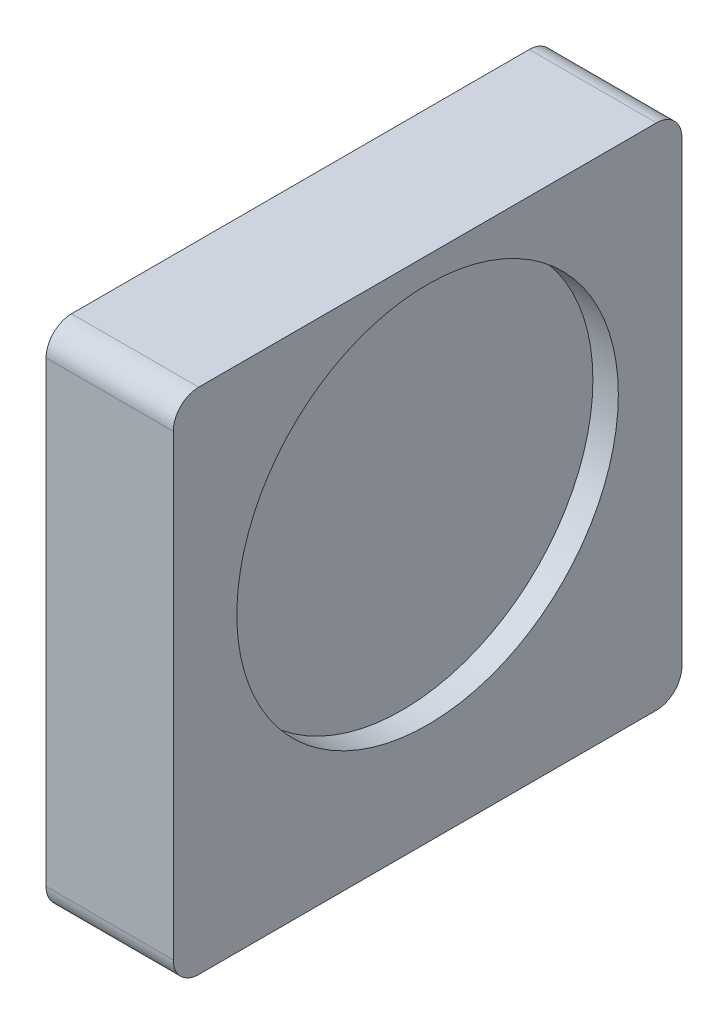
from build123d import *

# Parameters (mm, degrees)
SKETCH1_W           = 40
SKETCH1_H           = 40
BOSS_EXTRUDE1_DEPTH = 10
SKETCH2_R           = 15
CUT_EXTRUDE1_DEPTH  = 2
FILLET1_R           = 2


with BuildPart() as part:
    # Sketch1 → Boss-Extrude1 (new body)
    with BuildSketch(Plane.YZ):
        Rectangle(SKETCH1_W, SKETCH1_H)
    extrude(amount=BOSS_EXTRUDE1_DEPTH)

    # Sketch2 → Cut-Extrude1 (cut)
    with BuildSketch(Plane.YZ.offset(10)):
        with Locations(Location((3, 0, 0), (0, 0, 270))):
            Circle(SKETCH2_R)
    extrude(amount=-CUT_EXTRUDE1_DEPTH, mode=Mode.SUBTRACT)

    # Fillet1
    fillet1_edges = [part.edges().sort_by_distance(p)[0] for p in [
        (5, 20, -20),
        (5, -20, -20),
        (5, -20, 20),
        (5, 20, 20),
    ]]
    fillet(fillet1_edges, radius=FILLET1_R)


solid = part.part
